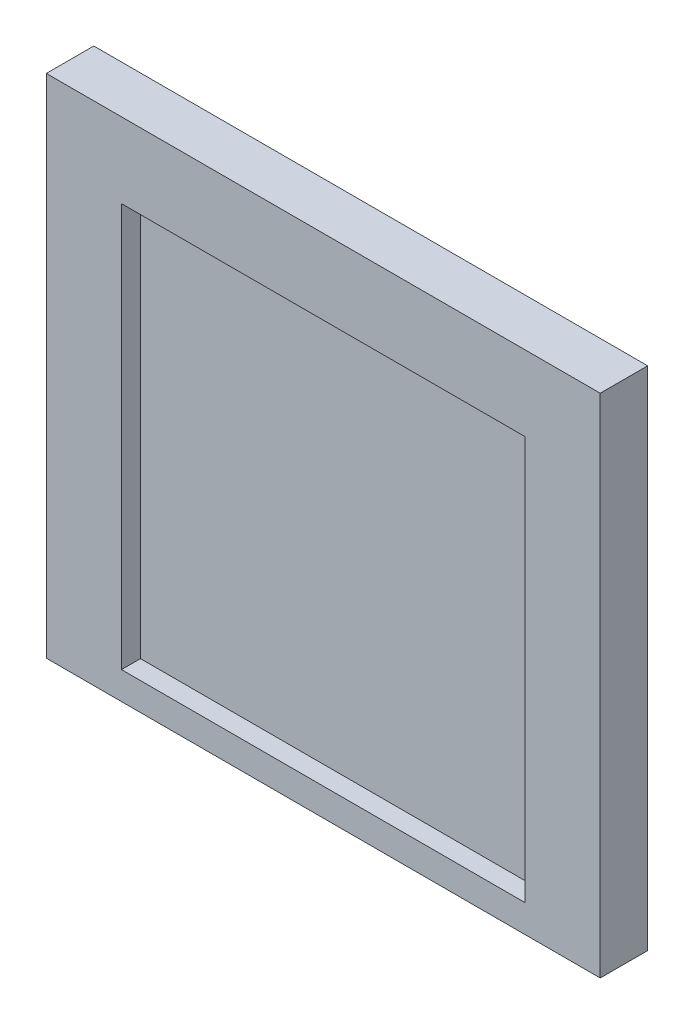
from build123d import *

# Parameters (mm, degrees)
SKETCH1_W           = 35
SKETCH1_H           = 35
BOSS_EXTRUDE1_DEPTH = 3
SKETCH2_W           = 25.5
SKETCH2_H           = 25.5
CUT_EXTRUDE1_DEPTH  = 1.2
SKETCH3_W           = 35
SKETCH3_H           = 3
CUT_EXTRUDE2_DEPTH  = 3


with BuildPart() as part:
    # Sketch1 → Boss-Extrude1 (new body)
    with BuildSketch(Plane.XY):
        with Locations((17.5, 17.5)):
            Rectangle(SKETCH1_W, SKETCH1_H)
    extrude(amount=BOSS_EXTRUDE1_DEPTH)

    # Sketch2 → Cut-Extrude1 (cut)
    with BuildSketch(Plane.XY.offset(3)):
        with Locations((17.5, 17.5)):
            Rectangle(SKETCH2_W, SKETCH2_H)
    extrude(amount=-CUT_EXTRUDE1_DEPTH, mode=Mode.SUBTRACT)

    # Sketch3 → Cut-Extrude2 (cut)
    with BuildSketch(Plane.XZ):
        with Locations((17.5, 1.5)):
            Rectangle(SKETCH3_W, SKETCH3_H)
    extrude(amount=-CUT_EXTRUDE2_DEPTH, mode=Mode.SUBTRACT)


solid = part.part
